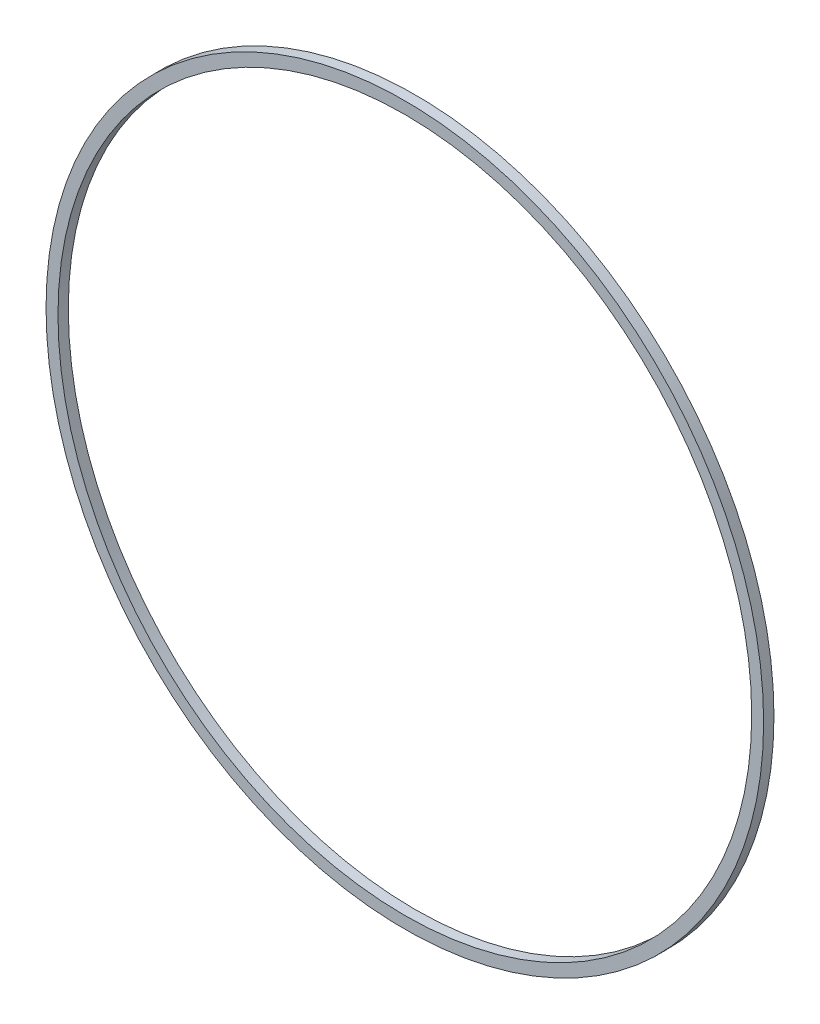
from build123d import *

# Parameters (mm, degrees)
SKETCH2_R           = 44.1325
BOSS_EXTRUDE1_DEPTH = 1.27
SKETCH3_R           = 42.6644522
CUT_EXTRUDE1_DEPTH  = 1.27


with BuildPart() as part:
    # Sketch2 → Boss-Extrude1 (new body)
    with BuildSketch(Plane.XY):
        Circle(SKETCH2_R)
    extrude(amount=BOSS_EXTRUDE1_DEPTH)

    # Sketch3 → Cut-Extrude1 (cut)
    with BuildSketch(Plane.XY.offset(1.27)):
        Circle(SKETCH3_R)
    extrude(amount=-CUT_EXTRUDE1_DEPTH, mode=Mode.SUBTRACT)


solid = part.part
